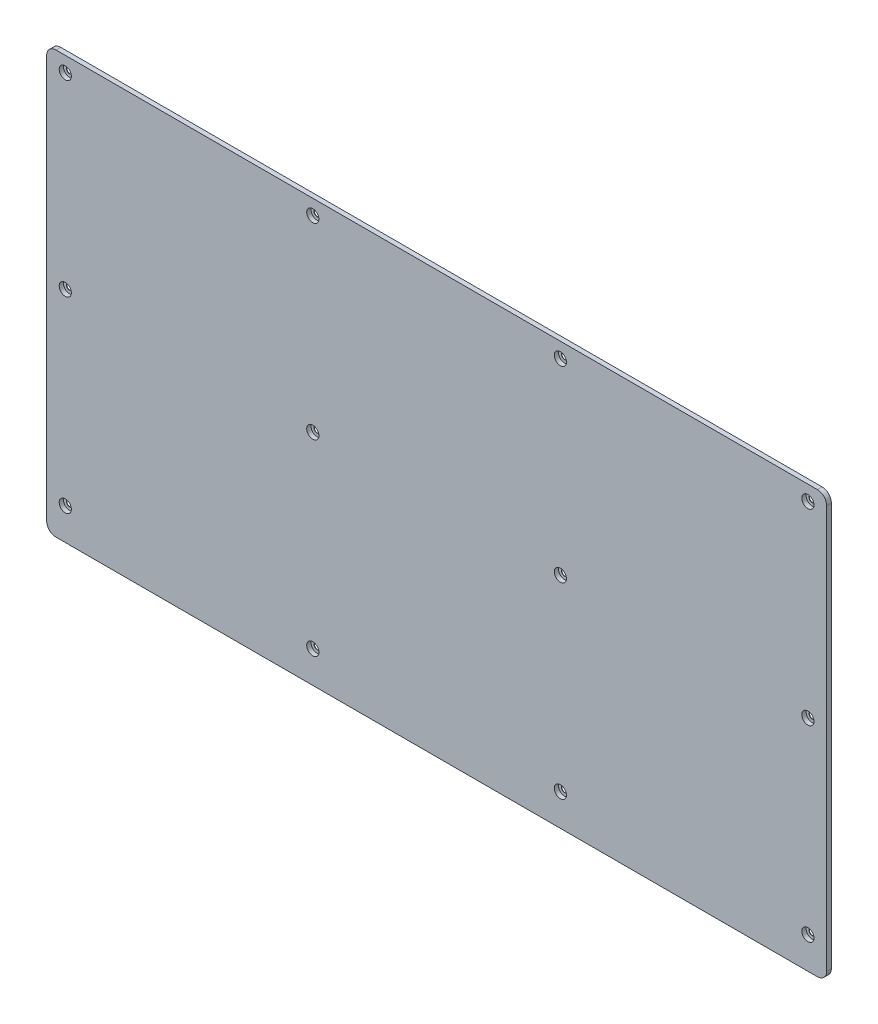
from build123d import *

# Parameters (mm, degrees)
BOSS_EXTRU_1_DEPTH              = 5
D_GAGEMENT_M61_D                = 6.6
R_P_TITION_LIN_AIRE1_COUNT      = 5
R_P_TITION_LIN_AIRE1_PITCH      = 100
R_P_TITION_LIN_AIRE1_COUNT_DIR2 = 4
R_P_TITION_LIN_AIRE1_PITCH_DIR2 = 264


with BuildPart() as part:
    # Esquisse1 → Boss.-Extru.1 (new body)
    with BuildSketch(Plane.XY):
        with BuildLine():
            Line((-406, -225), (406, -225))
            ThreePointArc((406, -225), (413.071067812, -222.071067812), (416, -215))
            Line((416, -215), (416, 215))
            ThreePointArc((416, 215), (413.071067812, 222.071067812), (406, 225))
            Line((406, 225), (-406, 225))
            ThreePointArc((-406, 225), (-413.071067812, 222.071067812), (-416, 215))
            Line((-416, 215), (-416, -215))
            ThreePointArc((-416, -215), (-413.071067812, -222.071067812), (-406, -225))
        make_face()
    extrude(amount=BOSS_EXTRU_1_DEPTH)

    # Dégagement M61 (through all)
    with Locations(Plane(origin=(0, 0, 0), x_dir=(-1, 0, 0), z_dir=(0, 0, -1))):
        with Locations((-395.919753935, 208.872368656)):
            Hole(D_GAGEMENT_M61_D / 2)

    # Esquisse4 → Chambrage pour vis à tête ronde bombée M61 (revolve, cut)
    with BuildSketch(Plane(origin=(395.919753935, 208.872368656, 5), x_dir=(0, -1, 0), z_dir=(1, 0, 0))):
        Polygon((0, 0), (0, 5), (3.3, 5), (3.3, 4.625), (3.325, 4.6), (6.5, 4.6), (6.5, 0), align=None)
    chambrage_pour_vis_t_te_ronde_bomb_e_m = revolve(axis=Axis((395.919753935, 208.872368656, 11.35), (0, 0, -1)), mode=Mode.SUBTRACT)

    # Répétition linéaire1: Chambrage pour vis _ t_te ronde bomb_e M 5 × 4, 8 skipped
    with Locations(*[(-j * R_P_TITION_LIN_AIRE1_PITCH_DIR2, -i * R_P_TITION_LIN_AIRE1_PITCH, 0) for i in range(R_P_TITION_LIN_AIRE1_COUNT) for j in range(R_P_TITION_LIN_AIRE1_COUNT_DIR2) if (i, j) not in ((0, 0), (1, 0), (1, 1), (1, 2), (1, 3), (3, 0), (3, 1), (3, 2), (3, 3))]):
        add(chambrage_pour_vis_t_te_ronde_bomb_e_m, mode=Mode.SUBTRACT)


solid = part.part
